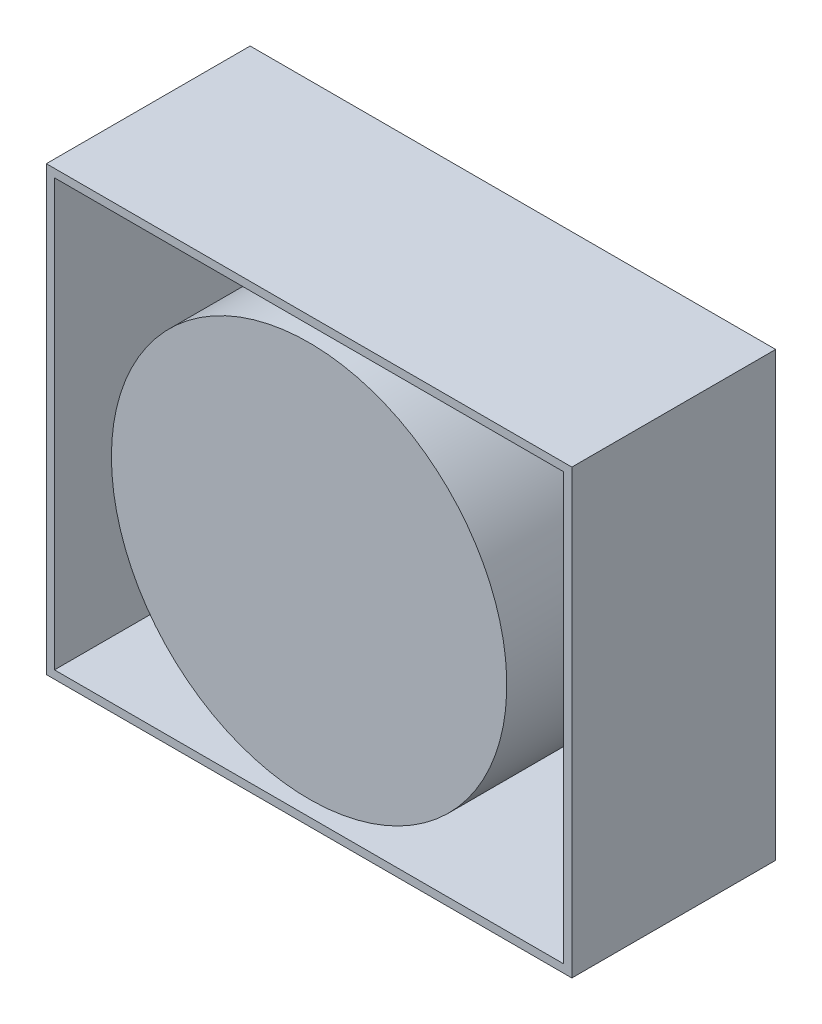
from build123d import *

# Parameters (mm, degrees)
SKETCH1_W             = 128.922622712
SKETCH1_H             = 108.547542538
SKETCH1_W_2           = 124.922622712
SKETCH1_H_2           = 104.547542538
BOSS_EXTRUDE1_DEPTH   = 50
SKETCH2_R             = 48.496570744
BOSS_EXTRUDE2_DEPTH   = 50
SKETCH3_R             = 6.994110628
BOSS_EXTRUDE3_DEPTH   = 20
SKETCH3_R_2           = 6.120691225
BOSS_EXTRUDE3_2_DEPTH = 20


with BuildPart() as part:
    # Sketch1 → Boss-Extrude1 (new body)
    with BuildSketch(Plane.XY):
        Rectangle(SKETCH1_W, SKETCH1_H)
        Rectangle(SKETCH1_W_2, SKETCH1_H_2, mode=Mode.SUBTRACT)
    extrude(amount=BOSS_EXTRUDE1_DEPTH)


with BuildPart() as body_2:
    # Sketch2 → Boss-Extrude2 (new body)
    with BuildSketch(Plane.XY):
        with Locations(Location((0, 0, 0), (0, 0, 180))):
            Circle(SKETCH2_R)
    extrude(amount=BOSS_EXTRUDE2_DEPTH)


with BuildPart() as body_3:
    # Sketch3 → Boss-Extrude3 (new body)
    with BuildSketch(Plane.XY):
        with Locations((-51.126362865, 41.516845757)):
            Circle(SKETCH3_R)
    extrude(amount=BOSS_EXTRUDE3_DEPTH)


with BuildPart() as body_4:
    # Sketch3 → Boss-Extrude3 2 (new body)
    with BuildSketch(Plane.XY):
        with Locations((46.461548735, 43.755956539)):
            Circle(SKETCH3_R_2)
    extrude(amount=BOSS_EXTRUDE3_2_DEPTH)


solid = Compound([part.part, body_2.part, body_3.part, body_4.part])
